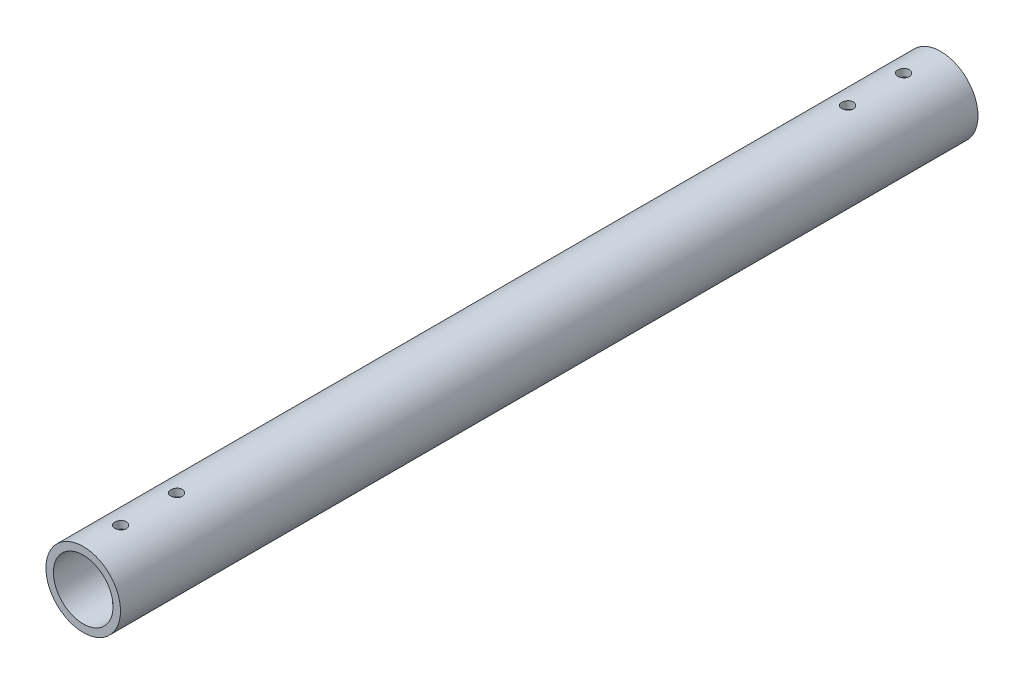
from build123d import *

# Parameters (mm, degrees)
SKETCH_1_R               = 10
SKETCH_1_R_2             = 8
EXTRUDE_1_DEPTH          = 230
CUT_EXTRUDE_1_DEPTH      = 231.434372436
CUT_EXTRUDE_1_DEPTH_BACK = 230
SKETCH_2_R               = 1.55


with BuildPart() as part:
    # 草图1 → 凸台-拉伸1 (new body)
    with BuildSketch(Plane.XY):
        Circle(SKETCH_1_R)
        Circle(SKETCH_1_R_2, mode=Mode.SUBTRACT)
    extrude(amount=EXTRUDE_1_DEPTH)

    # 草图2 → 切除-拉伸1 (cut, two sides: drawn at the far end of the back side and taken through both)
    with BuildSketch(Plane(origin=(0, 0, 0), x_dir=(1, 0, 0), z_dir=(0, 1, 0)).offset(-CUT_EXTRUDE_1_DEPTH_BACK)):
        with Locations(Location((0, -10, 0), (0, 0, 90))):
            Circle(SKETCH_2_R)
        with Locations(Location((0, -25, 0), (0, 0, 90))):
            Circle(SKETCH_2_R)
        with Locations(Location((0, -220, 0), (0, 0, 90))):
            Circle(SKETCH_2_R)
        with Locations(Location((0, -205, 0), (0, 0, 90))):
            Circle(SKETCH_2_R)
    extrude(amount=CUT_EXTRUDE_1_DEPTH + CUT_EXTRUDE_1_DEPTH_BACK, mode=Mode.SUBTRACT)


solid = part.part
